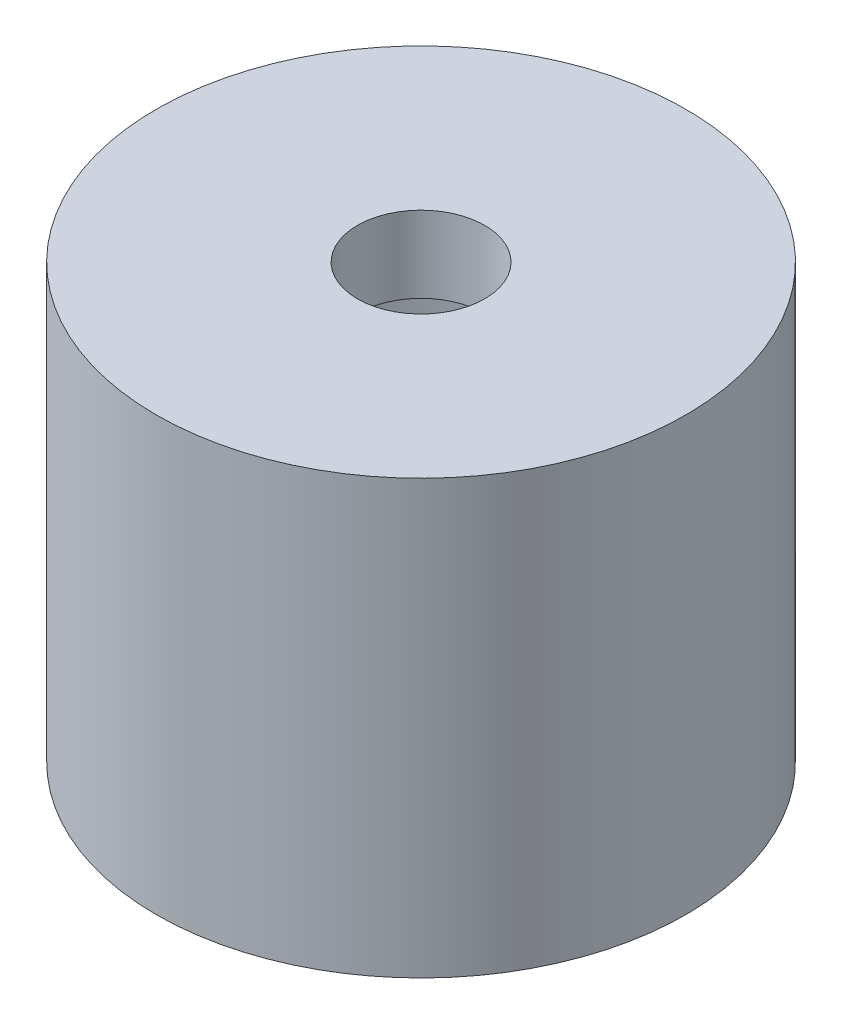
from build123d import *

# Parameters (mm, degrees)
SKETCH1_R                      = 16.51
SKETCH1_R_2                    = 13.97
BOSS_EXTRUDE1_DEPTH            = 22.225
BOSS_EXTRUDE2_START            = 4.7625
SKETCH1_2_R                    = 16.51
BOSS_EXTRUDE2_DEPTH            = 4.7625
F_5_16_0_3125_DIAMETER_HOLE1_D = 7.9375


with BuildPart() as part:
    # Sketch1 → Boss-Extrude1 (new body)
    with BuildSketch(Plane(origin=(0, 0, 0), x_dir=(1, 0, 0), z_dir=(0, 1, 0))):
        with Locations(Location((0, 0, 0), (0, 0, 270))):
            Circle(SKETCH1_R)
        with Locations(Location((0, 0, 0), (0, 0, 270))):
            Circle(SKETCH1_R_2, mode=Mode.SUBTRACT)
    extrude(amount=-BOSS_EXTRUDE1_DEPTH)

    # Sketch1<2> → Boss-Extrude2 (add)
    with BuildSketch(Plane(origin=(0, 0, 0), x_dir=(1, 0, 0), z_dir=(0, 1, 0)).offset(BOSS_EXTRUDE2_START)):
        with Locations(Location((0, 0, 0), (0, 0, 270))):
            Circle(SKETCH1_2_R)
    extrude(amount=-BOSS_EXTRUDE2_DEPTH)

    # 5/16 (0.3125) Diameter Hole1 (through all)
    with Locations(Plane(origin=(0, 4.7625, 0), x_dir=(1, 0, 0), z_dir=(0, 1, 0))):
        with Locations((0, 0)):
            Hole(F_5_16_0_3125_DIAMETER_HOLE1_D / 2)


solid = part.part
